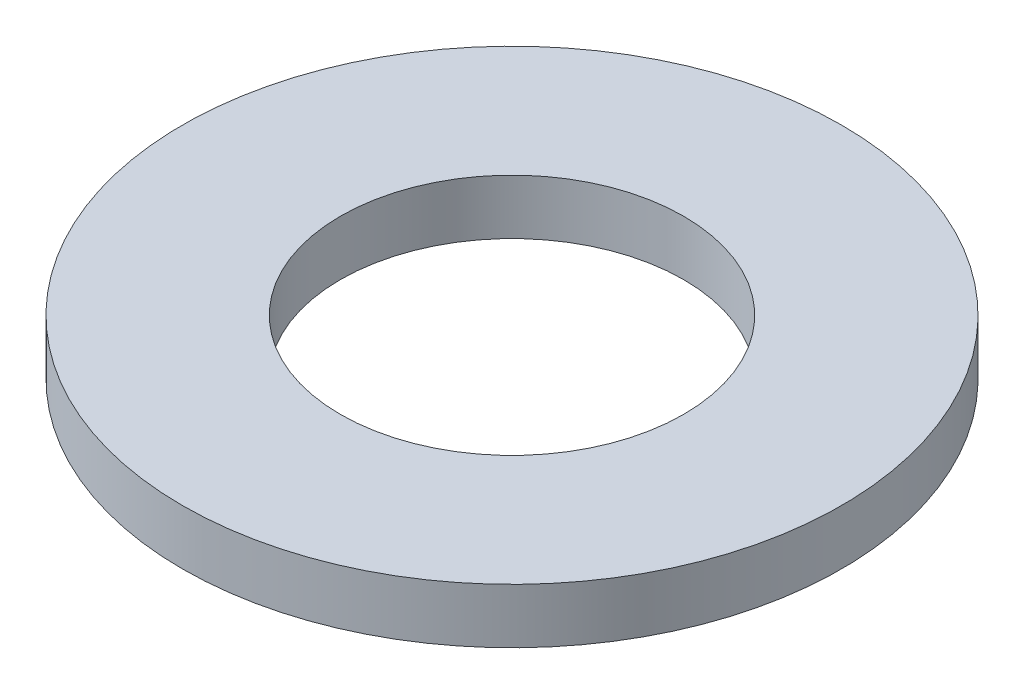
from build123d import *

# Parameters (mm, degrees)
SKETCH1_R           = 6
SKETCH1_R_2         = 3.125
BOSS_EXTRUDE1_DEPTH = 0.5


with BuildPart() as part:
    # Sketch1 → Boss-Extrude1 (new, symmetric)
    with BuildSketch(Plane(origin=(0, 0, 0), x_dir=(1, 0, 0), z_dir=(0, 1, 0))):
        with Locations(Location((0, 0, 0), (0, 0, 270))):
            Circle(SKETCH1_R)
        with Locations(Location((0, 0, 0), (0, 0, 270))):
            Circle(SKETCH1_R_2, mode=Mode.SUBTRACT)
    extrude(amount=BOSS_EXTRUDE1_DEPTH, both=True)


solid = part.part
